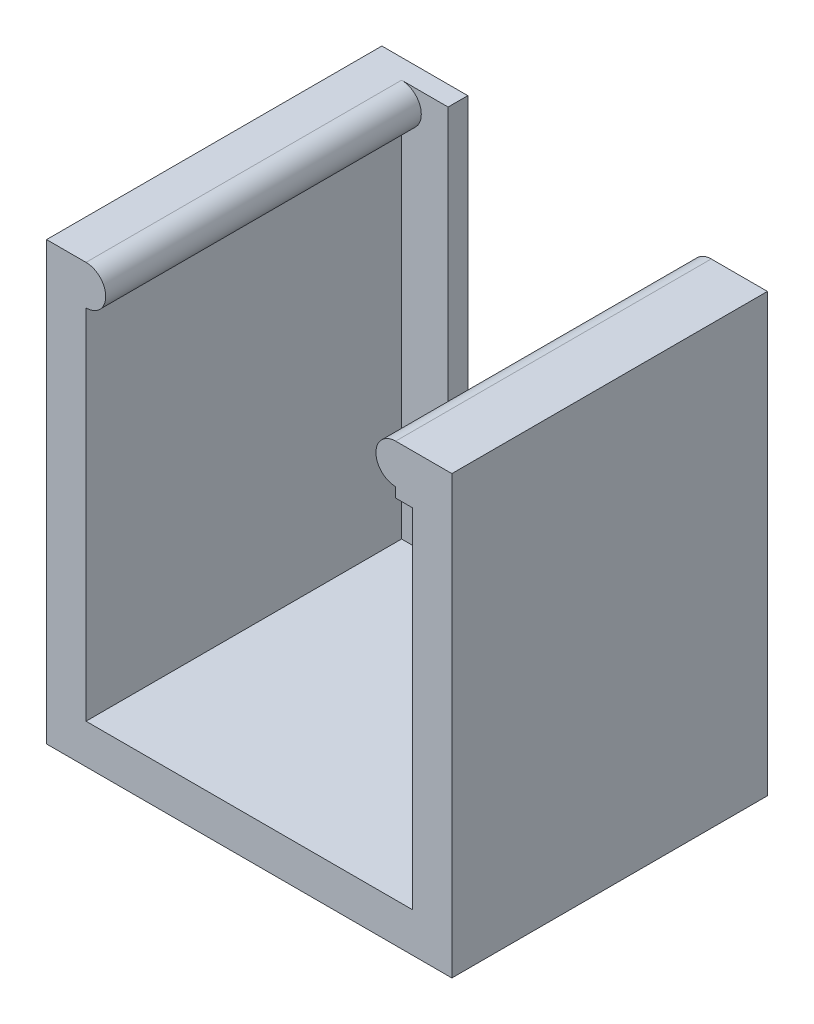
from build123d import *

# Parameters (mm, degrees)
SKETCH1_R             = 1
BOSS_EXTRUDE1_DEPTH   = 16
BOSS_EXTRUDE1_2_DEPTH = 16
BOSS_EXTRUDE2_DEPTH   = 16
SKETCH3_W             = 4.358106799
SKETCH3_H             = 21.361113411
BOSS_EXTRUDE4_DEPTH   = 1


with BuildPart() as part:
    # Sketch1 → Boss-Extrude1 (new body)
    with BuildSketch(Plane.XY):
        with Locations((-7.85, 0)):
            Circle(SKETCH1_R)
    extrude(amount=BOSS_EXTRUDE1_DEPTH)



with BuildPart() as body_2:
    # Sketch1 → Boss-Extrude1 2 (new body)
    with BuildSketch(Plane.XY):
        with Locations((7.85, 0)):
            Circle(SKETCH1_R)
    extrude(amount=BOSS_EXTRUDE1_2_DEPTH)


with BuildPart() as part_1:
    add(part.part)

    add(body_2.part)  # Boss-Extrude2 merges body 2
    # Sketch2 → Boss-Extrude2 (add, through all)
    with BuildSketch(Plane.XY):
        Polygon((7.85, 1), (10.7, 1), (10.7, -21.148770038), (-9.85, -21.148770038), (-9.85, 1), (-7.85, 1), (-7.85, -19.148770038), (8.7, -19.148770038), (8.7, -1.5), (7.85, -1.5), align=None)
    extrude(amount=BOSS_EXTRUDE2_DEPTH)

    # Sketch3 → Boss-Extrude4 (add)
    with BuildSketch(Plane.XY):
        with Locations((-7.670946601, -9.680556706)):
            Rectangle(SKETCH3_W, SKETCH3_H)
    extrude(amount=-BOSS_EXTRUDE4_DEPTH)


solid = part_1.part
